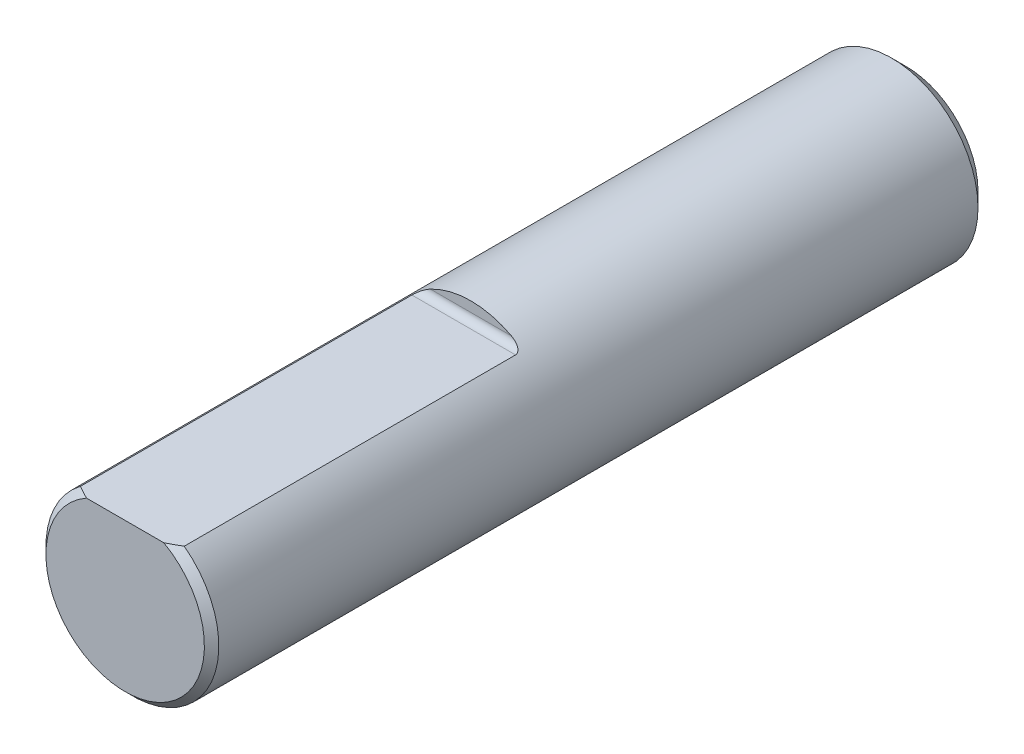
from build123d import *

# Parameters (mm, degrees)
CROQUIS1_R              = 3
SALIENTE_EXTRUIR1_DEPTH = 27.1
CORTAR_EXTRUIR1_START   = -12
CORTAR_EXTRUIR1_DEPTH   = 12
CHAFL_N1_SIZE           = 0.25
CUT_EXTRUDE2_DEPTH      = 2.5
CHAMFER1_SIZE           = 0.5
FILLET1_R               = 0.25


with BuildPart() as part:
    # Croquis1 → Saliente-Extruir1 (new body)
    with BuildSketch(Plane.XY):
        with Locations(Location((0, 0, 0), (0, 0, 180))):
            Circle(CROQUIS1_R)
    extrude(amount=SALIENTE_EXTRUIR1_DEPTH)

    # Croquis2 → Cortar-Extruir1 (cut)
    with BuildSketch(Plane.XY.offset(27.1).offset(CORTAR_EXTRUIR1_START)):
        with BuildLine():
            Line((-1.8, 2.4), (1.8, 2.4))
            ThreePointArc((1.8, 2.4), (0, 3), (-1.8, 2.4))
        make_face()
    extrude(amount=CORTAR_EXTRUIR1_DEPTH, mode=Mode.SUBTRACT)

    # Chaflán1
    chafl_n1_edges = [part.edges().sort_by_distance(p)[0] for p in [
        (1.341640786, -2.683281573, 27.1),
    ]]
    chamfer(chafl_n1_edges, length=CHAFL_N1_SIZE)

    # Sketch1 → Cut-Extrude2 (cut)
    with BuildSketch(Plane(origin=(0, 0, 0), x_dir=(-1, 0, 0), z_dir=(0, 0, -1))):
        with BuildLine():
            Line((0, 0.75), (-0.661437828, 0.75))
            ThreePointArc((-0.661437828, 0.75), (0, -1), (0.661437828, 0.75))
            Line((0.661437828, 0.75), (0, 0.75))
        make_face()
    extrude(amount=-CUT_EXTRUDE2_DEPTH, mode=Mode.SUBTRACT)

    # Chamfer1
    chamfer1_edges = [part.edges().sort_by_distance(p)[0] for p in [
        (3, 0, 0),
    ]]
    chamfer(chamfer1_edges, length=CHAMFER1_SIZE)

    # Fillet1
    fillet1_edges = [part.edges().sort_by_distance(p)[0] for p in [
        (0, 2.4, 15.1),
    ]]
    fillet(fillet1_edges, radius=FILLET1_R)


solid = part.part
